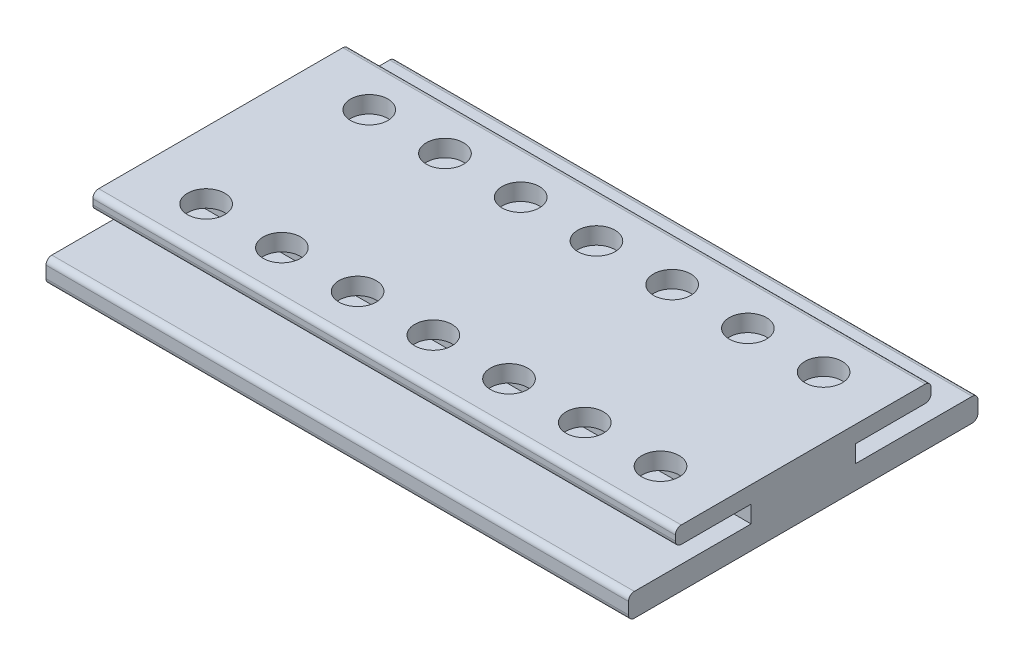
from build123d import *

# Parameters (mm, degrees)
EXTRUDE_1_DEPTH     = 100
SKETCH_3_R          = 3.2
CUT_EXTRUDE_1_DEPTH = 8
SKETCH_4_R          = 3.18
EXTRUDE_2_DEPTH     = 5.1


with BuildPart() as part:
    # 草图2 → 凸台-拉伸1 (new body)
    with BuildSketch(Plane(origin=(0, 0, 0), x_dir=(0, 0, -1), z_dir=(1, 0, 0))):
        with BuildLine():
            Line((-20.95, -1.45), (-8.95, -1.45))
            Line((-8.95, -1.45), (-8.95, -4.4))
            Line((-8.95, -4.4), (-29, -4.4))
            ThreePointArc((-29, -4.4), (-29.707106781, -4.692893219), (-30, -5.4))
            Line((-30, -5.4), (-30, -7.4))
            ThreePointArc((-30, -7.4), (-29.707106781, -8.107106781), (-29, -8.4))
            Line((-29, -8.4), (29, -8.4))
            ThreePointArc((29, -8.4), (29.707106781, -8.107106781), (30, -7.4))
            Line((30, -7.4), (30, -5.4))
            ThreePointArc((30, -5.4), (29.707106781, -4.692893219), (29, -4.4))
            Line((29, -4.4), (8.95, -4.4))
            Line((8.95, -4.4), (8.95, -1.45))
            Line((8.95, -1.45), (20.95, -1.45))
            ThreePointArc((20.95, -1.45), (21.657106781, -1.157106781), (21.95, -0.45))
            Line((21.95, -0.45), (21.95, 0.45))
            ThreePointArc((21.95, 0.45), (21.657106781, 1.157106781), (20.95, 1.45))
            Line((20.95, 1.45), (-20.95, 1.45))
            ThreePointArc((-20.95, 1.45), (-21.657106781, 1.157106781), (-21.95, 0.45))
            Line((-21.95, 0.45), (-21.95, -0.45))
            ThreePointArc((-21.95, -0.45), (-21.657106781, -1.157106781), (-20.95, -1.45))
        make_face()
    extrude(amount=EXTRUDE_1_DEPTH)

    # 草图3 → 切除-拉伸1 (cut)
    with BuildSketch(Plane(origin=(0, 1.45, 0), x_dir=(1, 0, 0), z_dir=(0, 1, 0))):
        with Locations(Location((11.492995831, 14, 0), (0, 0, 270))):
            Circle(SKETCH_3_R)
        with Locations(Location((24.492995831, 14, 0), (0, 0, 270))):
            Circle(SKETCH_3_R)
        with Locations(Location((37.492995831, 14, 0), (0, 0, 270))):
            Circle(SKETCH_3_R)
        with Locations(Location((50.492995831, 14, 0), (0, 0, 270))):
            Circle(SKETCH_3_R)
        with Locations(Location((63.492995831, 14, 0), (0, 0, 270))):
            Circle(SKETCH_3_R)
        with Locations(Location((76.492995831, 14, 0), (0, 0, 270))):
            Circle(SKETCH_3_R)
        with Locations(Location((89.492995831, 14, 0), (0, 0, 270))):
            Circle(SKETCH_3_R)
        with Locations(Location((89.492995831, -14, 0), (0, 0, 90))):
            Circle(SKETCH_3_R)
        with Locations(Location((76.492995831, -14, 0), (0, 0, 90))):
            Circle(SKETCH_3_R)
        with Locations(Location((63.492995831, -14, 0), (0, 0, 90))):
            Circle(SKETCH_3_R)
        with Locations(Location((50.492995831, -14, 0), (0, 0, 90))):
            Circle(SKETCH_3_R)
        with Locations(Location((37.492995831, -14, 0), (0, 0, 90))):
            Circle(SKETCH_3_R)
        with Locations(Location((24.492995831, -14, 0), (0, 0, 90))):
            Circle(SKETCH_3_R)
        with Locations(Location((11.492995831, -14, 0), (0, 0, 90))):
            Circle(SKETCH_3_R)
    extrude(amount=-CUT_EXTRUDE_1_DEPTH, mode=Mode.SUBTRACT)

    # 草图4 → 凸台-拉伸2 (add)
    with BuildSketch(Plane.XZ.offset(8.4)):
        with Locations(Location((11.9, 12.7, 0), (0, 0, 90))):
            Circle(SKETCH_4_R)
        with Locations(Location((37.3, 12.7, 0), (0, 0, 90))):
            Circle(SKETCH_4_R)
        with Locations(Location((62.7, 12.7, 0), (0, 0, 90))):
            Circle(SKETCH_4_R)
        with Locations(Location((88.1, 12.7, 0), (0, 0, 90))):
            Circle(SKETCH_4_R)
        with Locations(Location((62.7, -12.7, 0), (0, 0, 90))):
            Circle(SKETCH_4_R)
        with Locations(Location((37.3, -12.7, 0), (0, 0, 90))):
            Circle(SKETCH_4_R)
        with Locations(Location((11.9, -12.7, 0), (0, 0, 90))):
            Circle(SKETCH_4_R)
        with Locations(Location((88.1, -12.7, 0), (0, 0, 90))):
            Circle(SKETCH_4_R)
    extrude(amount=EXTRUDE_2_DEPTH)


solid = part.part
